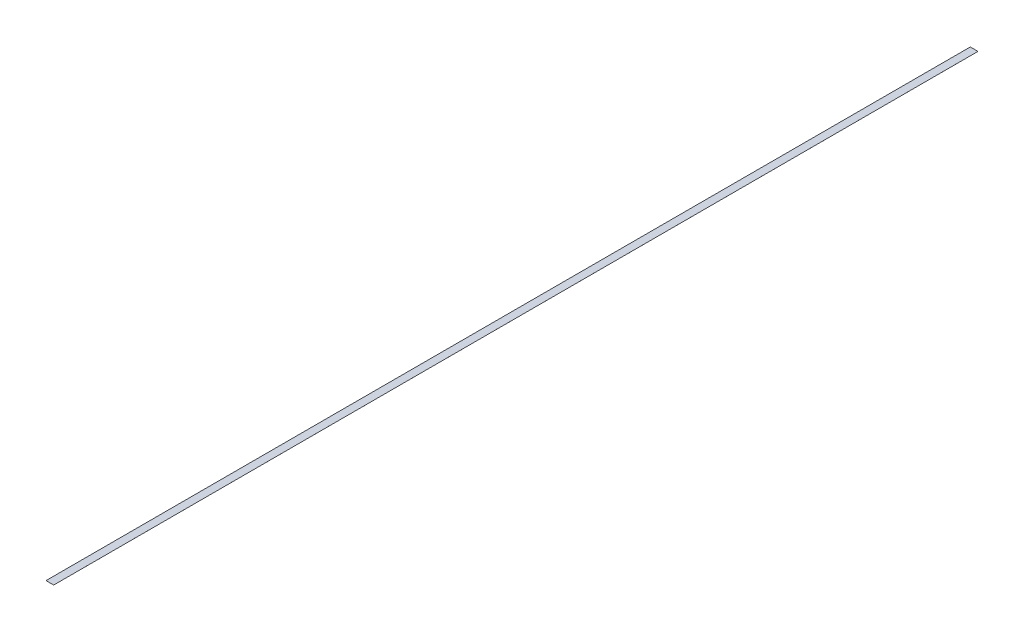
from build123d import *

# Parameters (mm, degrees)
SKETCH3_W           = 25.4
SKETCH3_H           = 0.0254
BOSS_EXTRUDE1_DEPTH = 1524


with BuildPart() as part:
    # Sketch3 → Boss-Extrude1 (new, symmetric)
    with BuildSketch(Plane.XY):
        Rectangle(SKETCH3_W, SKETCH3_H)
    extrude(amount=BOSS_EXTRUDE1_DEPTH, both=True)


solid = part.part
